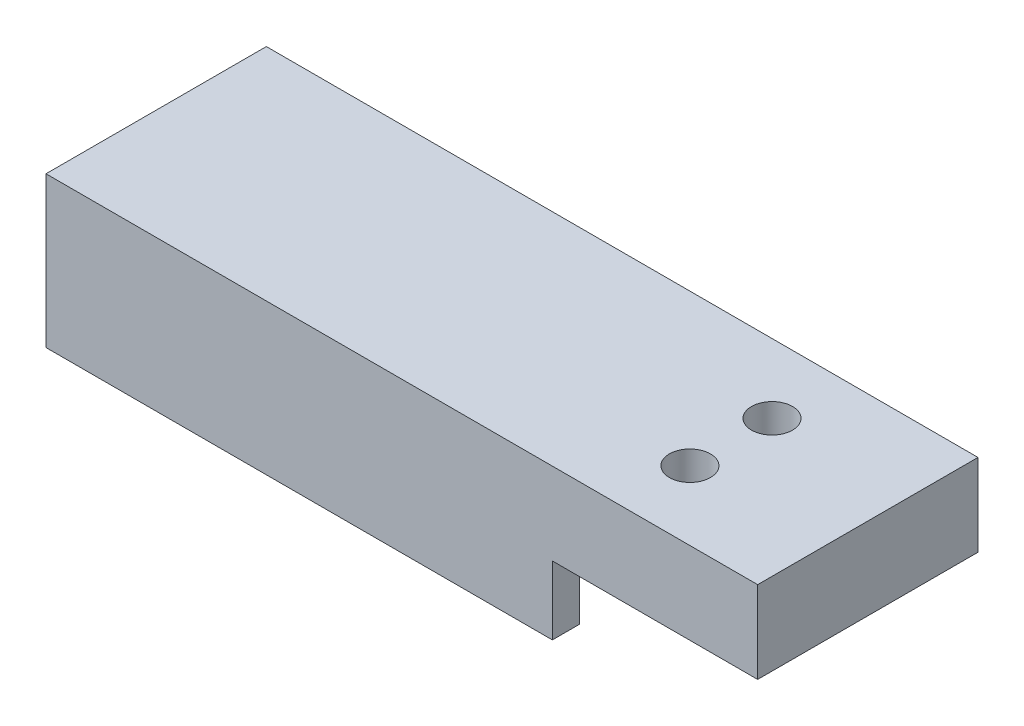
from build123d import *

# Parameters (mm, degrees)
BOSS_EXTRUDE1_DEPTH     = 5
BOSS_EXTRUDE2_DEPTH     = 6
SKETCH4_R               = 1.5
CUT_EXTRUDE1_DEPTH      = 29.806292715
CUT_EXTRUDE2_DEPTH      = 33.385336188
CUT_EXTRUDE2_DEPTH_BACK = 33.385336188
SKETCH5_W               = 15
SKETCH5_H               = 5


with BuildPart() as part:
    # Sketch2 → Boss-Extrude1 (new body)
    with BuildSketch(Plane(origin=(0, 0, 0), x_dir=(1, 0, 0), z_dir=(0, 1, 0))):
        Polygon((-27, 8.05), (25, 8.05), (25, 6.05), (-21.55, 6.05), (-25, 2.6), (-25, -2.6), (-21.55, -6.05), (25, -6.05), (25, -8.05), (-27, -8.05), align=None)
    extrude(amount=BOSS_EXTRUDE1_DEPTH)

    # Sketch3 → Boss-Extrude2 (add)
    with BuildSketch(Plane(origin=(0, 5, 0), x_dir=(1, 0, 0), z_dir=(0, 1, 0))):
        Polygon((25, 6.05), (25, -6.05), (25, -8.05), (-27, -8.05), (-27, 8.05), (25, 8.05), align=None)
    extrude(amount=BOSS_EXTRUDE2_DEPTH)

    # Sketch4 → Cut-Extrude1 (cut, through all)
    with BuildSketch(Plane.XZ.offset(-5)):
        with Locations(Location((15, 3, 0), (0, 0, 270))):
            Circle(SKETCH4_R)
        with Locations(Location((15, -3, 0), (0, 0, 270))):
            Circle(SKETCH4_R)
    extrude(amount=-CUT_EXTRUDE1_DEPTH, mode=Mode.SUBTRACT)

    # Sketch5 → Cut-Extrude2 (cut, two sides: drawn at the far end of the back side and taken through both)
    with BuildSketch(Plane(origin=(0, 0, 6.05), x_dir=(-1, 0, 0), z_dir=(0, 0, -1)).offset(-CUT_EXTRUDE2_DEPTH_BACK)):
        with Locations((-17.5, 2.5)):
            Rectangle(SKETCH5_W, SKETCH5_H)
    extrude(amount=CUT_EXTRUDE2_DEPTH + CUT_EXTRUDE2_DEPTH_BACK, mode=Mode.SUBTRACT)


solid = part.part
